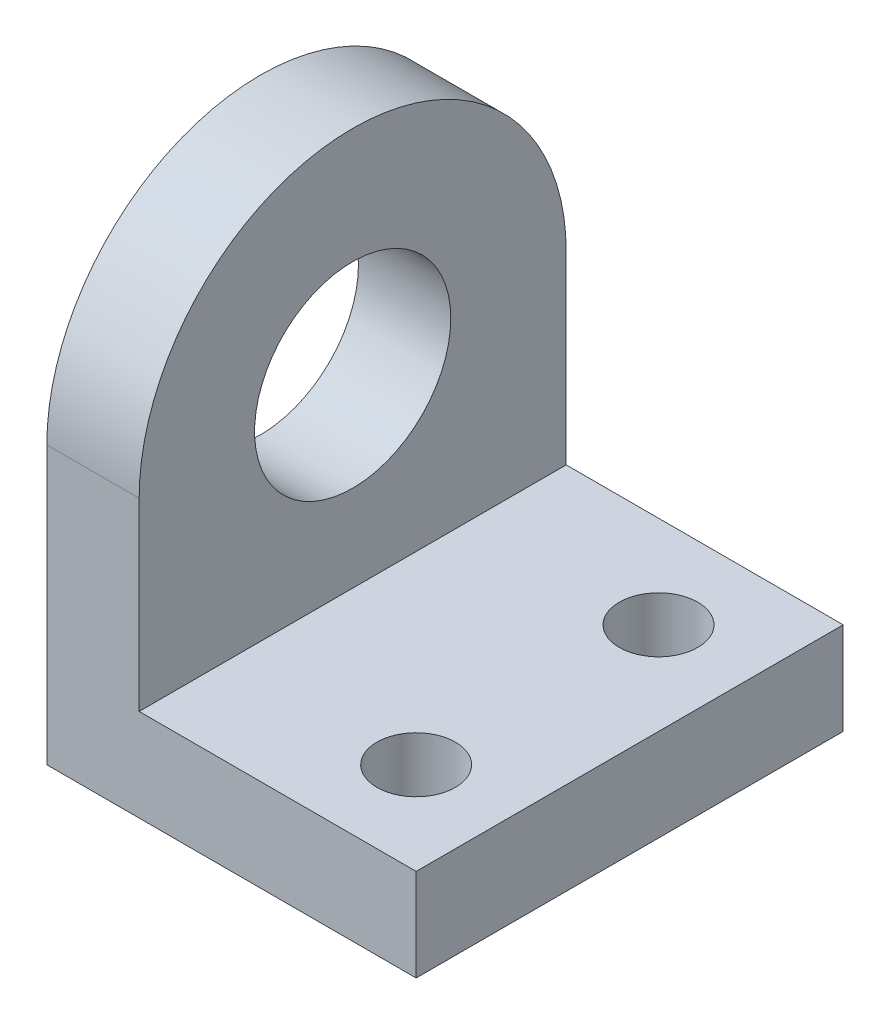
from build123d import *

# Parameters (mm, degrees)
SKETCH_1_R         = 4.25
EXTRUDE_1_DEPTH    = 4
SKETCH_2_W         = 18.5
SKETCH_2_H         = 4
EXTRUDE_2_DEPTH    = 12
HOLE_WIZARD_M3_1_D = 3.4


with BuildPart() as part:
    # 草图1 → 凸台-拉伸1 (new body)
    with BuildSketch(Plane(origin=(0, 0, 0), x_dir=(0, 0, -1), z_dir=(1, 0, 0))):
        with BuildLine():
            Line((-9.25, 0), (-9.25, -12))
            Line((-9.25, -12), (9.25, -12))
            Line((9.25, -12), (9.25, 0))
            ThreePointArc((9.25, 0), (0, 9.25), (-9.25, 0))
        make_face()
        Circle(SKETCH_1_R, mode=Mode.SUBTRACT)
    extrude(amount=EXTRUDE_1_DEPTH)

    # 草图2 → 凸台-拉伸2 (add)
    with BuildSketch(Plane(origin=(4, 0, 0), x_dir=(0, 0, -1), z_dir=(1, 0, 0))):
        with Locations((0, -10)):
            Rectangle(SKETCH_2_W, SKETCH_2_H)
    extrude(amount=EXTRUDE_2_DEPTH)

    # M3 间隙孔1 (through all)
    with Locations(Plane(origin=(0, -8, 0), x_dir=(1, 0, 0), z_dir=(0, 1, 0))):
        with Locations((12, 5.25), (12, -5.25)):
            Hole(HOLE_WIZARD_M3_1_D / 2)


solid = part.part
